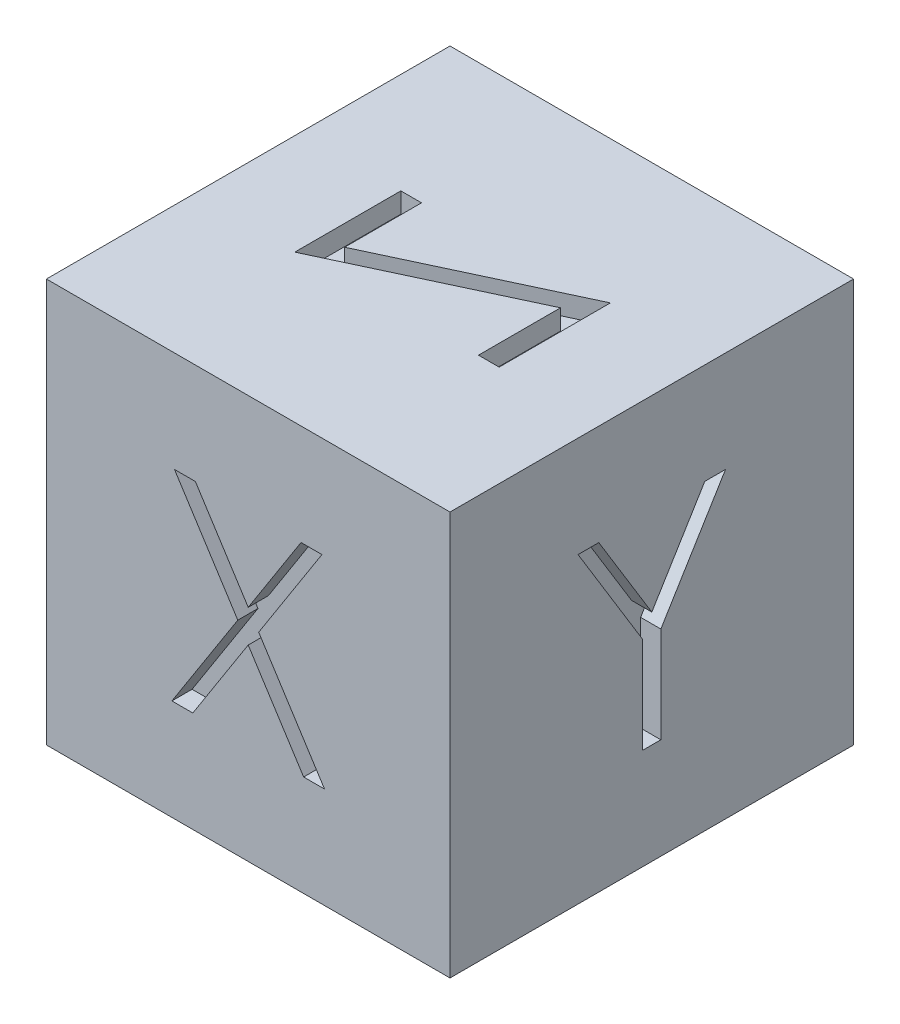
from build123d import *

# Parameters (mm, degrees)
SKETCH1_W           = 20
SKETCH1_H           = 20
BOSS_EXTRUDE1_DEPTH = 20
CUT_EXTRUDE_X_DEPTH = 1
CUT_EXTRUDE_Y_DEPTH = 1
CUT_EXTRUDE_Z_DEPTH = 1


with BuildPart() as part:
    # Sketch1 → Boss-Extrude1 (new body)
    with BuildSketch(Plane.XY):
        Rectangle(SKETCH1_W, SKETCH1_H)
    extrude(amount=BOSS_EXTRUDE1_DEPTH)

    # Sketch2 → Cut-Extrude X (cut)
    with BuildSketch(Plane.XY.offset(20)):
        Polygon((-3.653846154, 5), (-2.618189103, 5), (0, 0.909455128), (2.618189103, 5), (3.653846154, 5), (0.518830128, 0.100160256), (3.782051282, -5), (2.746394231, -5), (0, -0.709134615), (-2.746394231, -5), (-3.782051282, -5), (-0.516826923, 0.100160256), align=None)
    extrude(amount=-CUT_EXTRUDE_X_DEPTH, mode=Mode.SUBTRACT)

    # Sketch3 → Cut-Extrude Y (cut)
    with BuildSketch(Plane(origin=(10, 0, 0), x_dir=(0, 0, -1), z_dir=(1, 0, 0))):
        Polygon((-13.653846154, 5), (-12.626201923, 5), (-9.997996795, 0.703125), (-7.373798077, 5), (-6.346153846, 5), (-9.551282051, -0.246394231), (-9.551282051, -5), (-10.448717949, -5), (-10.448717949, -0.246394231), align=None)
    extrude(amount=-CUT_EXTRUDE_Y_DEPTH, mode=Mode.SUBTRACT)

    # Sketch4 → Cut-Extrude Z (cut)
    with BuildSketch(Plane(origin=(0, 10, 0), x_dir=(1, 0, 0), z_dir=(0, 1, 0))):
        Polygon((-3.974358974, -7.435897436), (-5, -7.435897436), (-5, -12.692307692), (3.974358974, -8.497596154), (3.974358974, -12.564102564), (5, -12.564102564), (5, -7.051282051), (-3.974358974, -11.24599359), align=None)
    extrude(amount=-CUT_EXTRUDE_Z_DEPTH, mode=Mode.SUBTRACT)


solid = part.part
